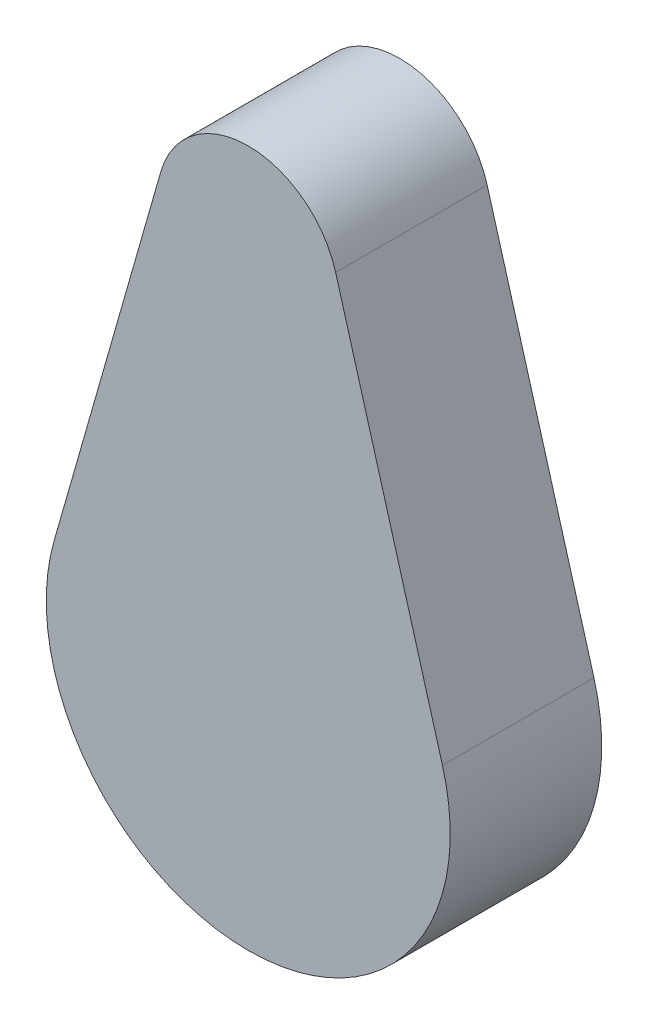
from build123d import *

# Parameters (mm, degrees)
SALIENTE_EXTRUIR2_DEPTH = 15
CROQUIS2_R              = 12
SALIENTE_EXTRUIR3_DEPTH = 12


with BuildPart() as part:
    # Croquis1 → Saliente-Extruir2 (new, symmetric)
    with BuildSketch(Plane.XY):
        with BuildLine():
            Line((-17.305996071, 4.95), (-38.457769046, -69))
            ThreePointArc((-38.457769046, -69), (0, -120), (38.457769046, -69))
            Line((38.457769046, -69), (17.305996071, 4.95))
            ThreePointArc((17.305996071, 4.95), (0, 18), (-17.305996071, 4.95))
        make_face()
    extrude(amount=SALIENTE_EXTRUIR2_DEPTH, both=True)

    # Croquis2 → Saliente-Extruir3 (add)
    with BuildSketch(Plane(origin=(0, 0, -15), x_dir=(-1, 0, 0), z_dir=(0, 0, -1))):
        with Locations(Location((0, -80, 0), (0, 0, 180))):
            Circle(CROQUIS2_R)
    extrude(amount=SALIENTE_EXTRUIR3_DEPTH)


solid = part.part
